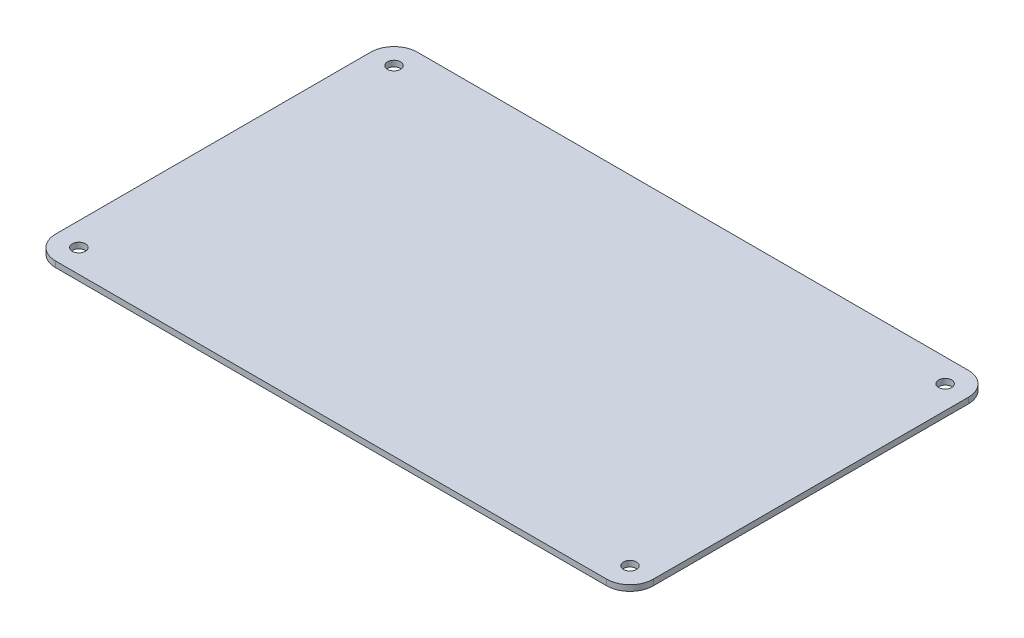
from build123d import *

# Parameters (mm, degrees)
BOSS_EXTRUDE1_DEPTH     = 3.175
F_1_4_CLEARANCE_HOLE1_D = 7.14248


with BuildPart() as part:
    # Sketch1 → Boss-Extrude1 (new body)
    with BuildSketch(Plane(origin=(0, 0, 0), x_dir=(1, 0, 0), z_dir=(0, 1, 0))):
        with BuildLine():
            Line((-150.2918, 98.63963), (150.2918, 98.63963))
            ThreePointArc((150.2918, 98.63963), (159.272056121, 94.919886121), (162.9918, 85.93963))
            Line((162.9918, 85.93963), (162.9918, -85.93963))
            ThreePointArc((162.9918, -85.93963), (159.272056121, -94.919886121), (150.2918, -98.63963))
            Line((150.2918, -98.63963), (-150.2918, -98.63963))
            ThreePointArc((-150.2918, -98.63963), (-159.272056121, -94.919886121), (-162.9918, -85.93963))
            Line((-162.9918, -85.93963), (-162.9918, 85.93963))
            ThreePointArc((-162.9918, 85.93963), (-159.272056121, 94.919886121), (-150.2918, 98.63963))
        make_face()
    extrude(amount=BOSS_EXTRUDE1_DEPTH)

    # 1/4 Clearance Hole1 (through all)
    with Locations(Plane(origin=(0, 3.175, 0), x_dir=(1, 0, 0), z_dir=(0, 1, 0))):
        with Locations((-150.2918, 85.93963), (150.2918, 85.93963), (150.2918, -85.93963), (-150.2918, -85.93963)):
            Hole(F_1_4_CLEARANCE_HOLE1_D / 2)


solid = part.part
